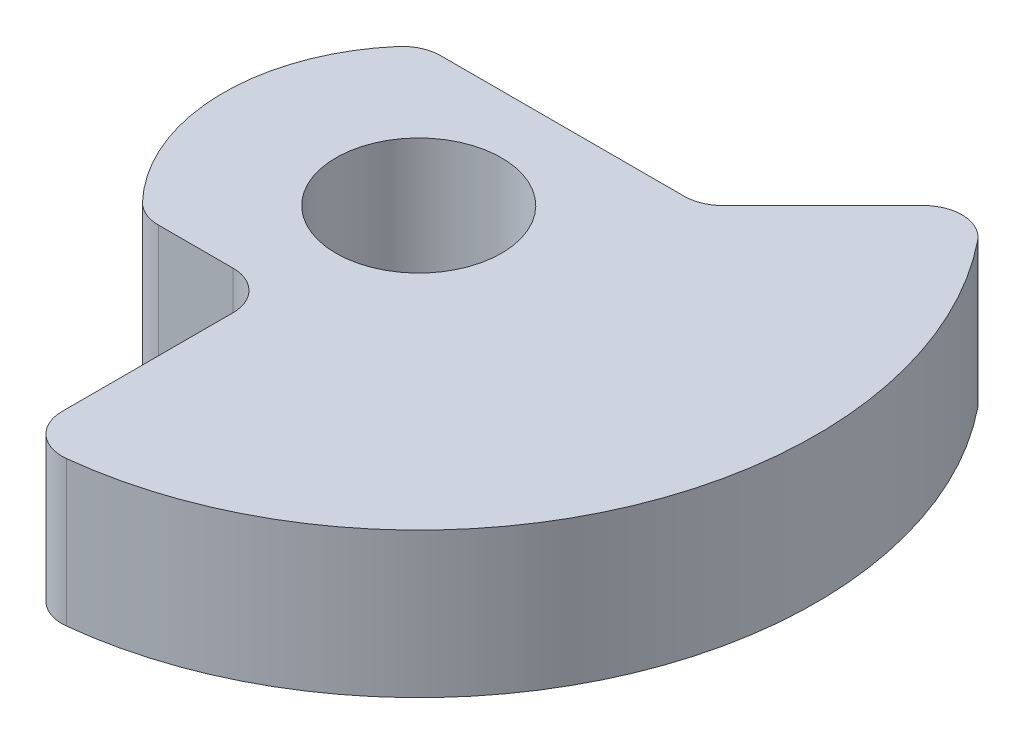
from build123d import *

# Parameters (mm, degrees)
SKETCH11_R     = 5.434276133
EXTRUDE5_DEPTH = 9.525
FILLET2_R      = 2.54
FILLET1_R      = 2.54
FILLET3_R      = 2.54


with BuildPart() as part:
    # Sketch11 → Extrude5 (new body)
    # profile 1 of 4: a face of its own
    with BuildSketch(Plane(origin=(0, 0, 0), x_dir=(1, 0, 0), z_dir=(0, 1, 0))):
        with BuildLine():
            Line((68.401879092, -7.643838899), (59.189110378, -16.856607613))
            Line((59.189110378, -16.856607613), (41.505666101, -16.856607613))
            ThreePointArc((41.505666101, -16.856607613), (41.271917597, -16.860911304), (41.038485938, -16.873816546))
            ThreePointArc((41.038485938, -16.873816546), (37.127788442, -26.414950032), (41.505666101, -35.750954012))
            Line((41.505666101, -35.750954012), (49.948049738, -35.750954012))
            Line((49.948049738, -35.750954012), (49.948049738, -52.195324003))
            ThreePointArc((49.948049738, -52.195324003), (68.401879092, -44.551497607), (76.045705488, -26.097668253))
            ThreePointArc((76.045705488, -26.097668253), (74.059139732, -16.110527774), (68.401879092, -7.643838899))
        make_face()
        with Locations(Location((49.948049738, -26.097668253, 0), (0, 0, 270))):
            Circle(SKETCH11_R, mode=Mode.SUBTRACT)
    # profile 2 of 4: a face of its own
    with BuildSketch(Plane(origin=(0, 0, 0), x_dir=(1, 0, 0), z_dir=(0, 1, 0))):
        with BuildLine():
            Line((68.401879092, -7.643838899), (59.189110378, -16.856607613))
            Line((59.189110378, -16.856607613), (41.505666101, -16.856607613))
            ThreePointArc((41.505666101, -16.856607613), (41.271917597, -16.860911304), (41.038485938, -16.873816546))
            ThreePointArc((41.038485938, -16.873816546), (37.127788442, -26.414950032), (41.505666101, -35.750954012))
            Line((41.505666101, -35.750954012), (49.948049738, -35.750954012))
            Line((49.948049738, -35.750954012), (49.948049738, -52.195324003))
            ThreePointArc((49.948049738, -52.195324003), (68.401879092, -44.551497607), (76.045705488, -26.097668253))
            ThreePointArc((76.045705488, -26.097668253), (74.059139732, -16.110527774), (68.401879092, -7.643838899))
        make_face()
        with Locations(Location((49.948049738, -26.097668253, 0), (0, 0, 270))):
            Circle(SKETCH11_R, mode=Mode.SUBTRACT)
    # profile 3 of 4: a face of its own
    with BuildSketch(Plane(origin=(0, 0, 0), x_dir=(1, 0, 0), z_dir=(0, 1, 0))):
        with BuildLine():
            Line((68.401879092, -7.643838899), (59.189110378, -16.856607613))
            Line((59.189110378, -16.856607613), (41.505666101, -16.856607613))
            ThreePointArc((41.505666101, -16.856607613), (41.271917597, -16.860911304), (41.038485938, -16.873816546))
            ThreePointArc((41.038485938, -16.873816546), (37.127788442, -26.414950032), (41.505666101, -35.750954012))
            Line((41.505666101, -35.750954012), (49.948049738, -35.750954012))
            Line((49.948049738, -35.750954012), (49.948049738, -52.195324003))
            ThreePointArc((49.948049738, -52.195324003), (68.401879092, -44.551497607), (76.045705488, -26.097668253))
            ThreePointArc((76.045705488, -26.097668253), (74.059139732, -16.110527774), (68.401879092, -7.643838899))
        make_face()
        with Locations(Location((49.948049738, -26.097668253, 0), (0, 0, 270))):
            Circle(SKETCH11_R, mode=Mode.SUBTRACT)
    # profile 4 of 4: a face of its own
    with BuildSketch(Plane(origin=(0, 0, 0), x_dir=(1, 0, 0), z_dir=(0, 1, 0))):
        with BuildLine():
            Line((68.401879092, -7.643838899), (59.189110378, -16.856607613))
            Line((59.189110378, -16.856607613), (41.505666101, -16.856607613))
            ThreePointArc((41.505666101, -16.856607613), (41.271917597, -16.860911304), (41.038485938, -16.873816546))
            ThreePointArc((41.038485938, -16.873816546), (37.127788442, -26.414950032), (41.505666101, -35.750954012))
            Line((41.505666101, -35.750954012), (49.948049738, -35.750954012))
            Line((49.948049738, -35.750954012), (49.948049738, -52.195324003))
            ThreePointArc((49.948049738, -52.195324003), (68.401879092, -44.551497607), (76.045705488, -26.097668253))
            ThreePointArc((76.045705488, -26.097668253), (74.059139732, -16.110527774), (68.401879092, -7.643838899))
        make_face()
        with Locations(Location((49.948049738, -26.097668253, 0), (0, 0, 270))):
            Circle(SKETCH11_R, mode=Mode.SUBTRACT)
    extrude(amount=-EXTRUDE5_DEPTH)

    # Fillet2
    fillet2_edges = [part.edges().sort_by_distance(p)[0] for p in [
        (59.189110378, -4.7625, 16.856607613),
        (49.948049738, -4.7625, 35.750954012),
    ]]
    fillet(fillet2_edges, radius=FILLET2_R)

    # Fillet1
    fillet1_edges = [part.edges().sort_by_distance(p)[0] for p in [
        (68.401879092, -4.7625, 7.643838899),
        (49.948049738, -4.7625, 52.195324003),
    ]]
    fillet(fillet1_edges, radius=FILLET1_R)

    # Fillet3
    fillet3_edges = [part.edges().sort_by_distance(p)[0] for p in [
        (41.038485938, -4.7625, 16.873816546),
        (41.505666101, -4.7625, 35.750954012),
    ]]
    fillet(fillet3_edges, radius=FILLET3_R)


solid = part.part
